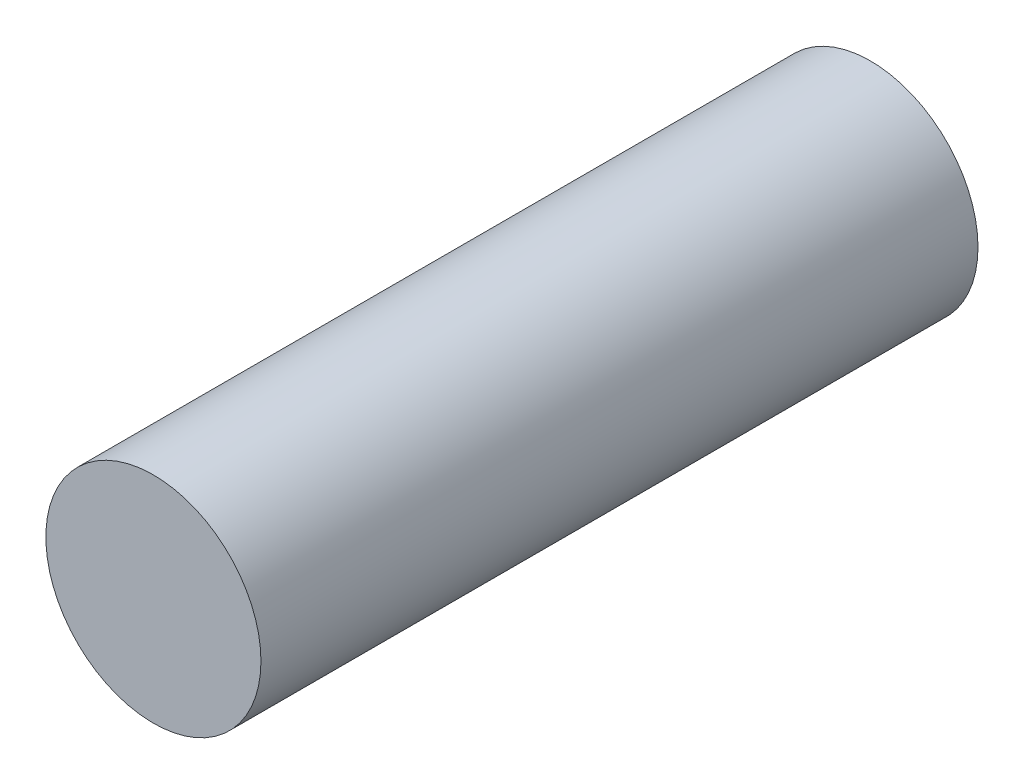
from build123d import *

# Parameters (mm, degrees)
SKETCH_1_R      = 9
EXTRUDE_1_DEPTH = 60


with BuildPart() as part:
    # Эскиз1 → Бобышка-Вытянуть1 (new body)
    with BuildSketch(Plane.XY):
        Circle(SKETCH_1_R)
    extrude(amount=EXTRUDE_1_DEPTH)


solid = part.part
